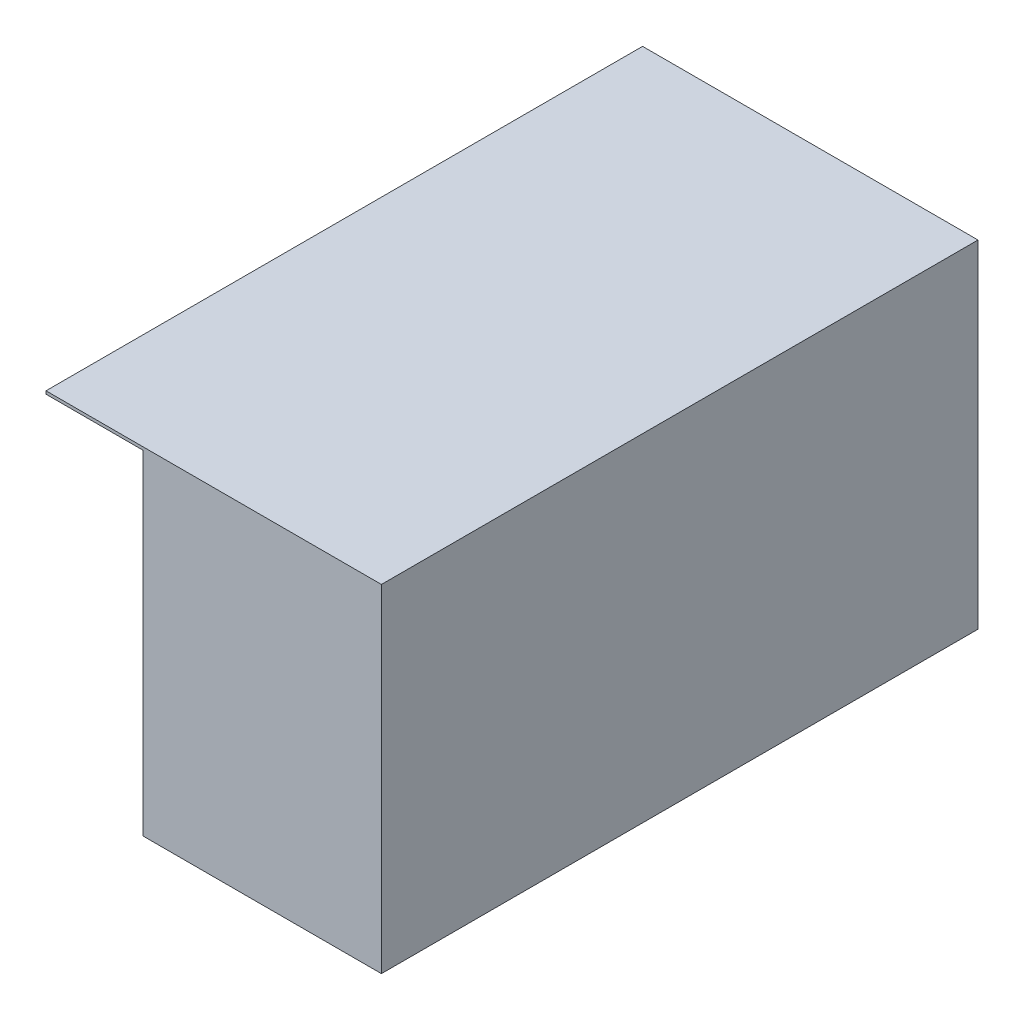
from build123d import *

# Parameters (mm, degrees)
SKETCH2_W           = 80
SKETCH2_H           = 112
BOSS_EXTRUDE2_DEPTH = 200
SKETCH3_W           = 43.75859647
SKETCH3_H           = 72.985244682
CUT_EXTRUDE1_DEPTH  = 70
SKETCH4_W           = 73.021311137
SKETCH4_H           = 192.612336009
CUT_EXTRUDE2_DEPTH  = 110
SKETCH5_W           = 55.513843859
SKETCH5_H           = 4.359725958
BOSS_EXTRUDE3_DEPTH = 30
SKETCH6_W           = 2.442307693
SKETCH6_H           = 19.05
BOSS_EXTRUDE4_DEPTH = 2.5
SKETCH7_W           = 112.444397653
SKETCH7_H           = 200
BOSS_EXTRUDE5_DEPTH = 1
SKETCH8_W           = 80
SKETCH8_H           = 200
BOSS_EXTRUDE6_DEPTH = 0.5
SKETCH9_W           = 29.219763648
SKETCH9_H           = 3.519384488
CUT_EXTRUDE3_DEPTH  = 60


with BuildPart() as part:
    # Sketch2 → Boss-Extrude2 (new body)
    with BuildSketch(Plane.XY):
        with Locations((7.037037037, 44.518518519)):
            Rectangle(SKETCH2_W, SKETCH2_H)
    extrude(amount=BOSS_EXTRUDE2_DEPTH)

    # Sketch3 → Cut-Extrude1 (cut)
    with BuildSketch(Plane.ZY.offset(32.962962963)):
        with Locations((169.213687293, 25.01114086)):
            Rectangle(SKETCH3_W, SKETCH3_H)
    extrude(amount=-CUT_EXTRUDE1_DEPTH, mode=Mode.SUBTRACT)

    # Sketch4 → Cut-Extrude2 (cut)
    with BuildSketch(Plane.XZ.offset(11.481481481)):
        with Locations((6.664479328, 99.376051132)):
            Rectangle(SKETCH4_W, SKETCH4_H)
    extrude(amount=-CUT_EXTRUDE2_DEPTH, mode=Mode.SUBTRACT)

    # Sketch5 → Boss-Extrude3 (add)
    with BuildSketch(Plane.ZY.offset(32.962962963)):
        with Locations((61.523642213, 30.131422859)):
            Rectangle(SKETCH5_W, SKETCH5_H)
    extrude(amount=BOSS_EXTRUDE3_DEPTH)

    # Sketch6 → Boss-Extrude4 (add)
    # profile 1 of 10: a face of its own
    with BuildSketch(Plane.ZY.offset(32.962962963)):
        with BuildLine():
            Line((34.641440783, 90.700838702), (32.695226841, 89.357569471))
            add(Edge.make_bspline(
                [(32.695226841, 89.357569471), (32.462126741, 89.612896003), (32.005805468, 90.112728171), (31.254357046, 90.767477473), (30.467934785, 91.318551672), (29.645431326, 91.764116092), (28.785975839, 92.11292244), (27.885047506, 92.355284544), (26.941705085, 92.504646837), (26.298721089, 92.523147207), (25.971248476, 92.532569471)],
                knots=[0, 0, 0, 0, 1.078723025, 2.111729107, 3.104379151, 4.071093171, 5.02612831, 5.993405043, 6.978038489, 8, 8, 8, 8], degree=3))
            add(Edge.make_bspline(
                [(25.971248476, 92.532569471), (25.800650107, 92.53011051), (25.461261775, 92.525218655), (24.958328239, 92.471436132), (24.463087429, 92.397822867), (23.976005303, 92.285975105), (23.497947164, 92.139755046), (23.025655745, 91.970184234), (22.566283343, 91.760153887), (22.115373688, 91.526706475), (21.679692287, 91.264129872), (21.269319104, 90.972491776), (20.87678796, 90.664823623), (20.513196342, 90.326578843), (20.175226188, 89.963693748), (19.855474167, 89.580734937), (19.562022008, 89.172721204), (19.295997639, 88.740875742), (19.053342732, 88.291632917), (18.849703179, 87.821700195), (18.672905501, 87.3390496), (18.526187259, 86.8411679), (18.417673448, 86.326547022), (18.337211972, 85.796587769), (18.285649654, 85.252463995), (18.280550514, 84.883936365), (18.277979245, 84.698104327)],
                knots=[0, 0, 0, 0, 1.002068956, 1.993515617, 2.969284448, 3.943018425, 4.926742606, 5.905741285, 6.889351865, 7.892340394, 8.888397413, 9.875523532, 10.849114049, 11.817064186, 12.790109362, 13.76151668, 14.746886598, 15.740472426, 16.740336546, 17.744438579, 18.747064952, 19.759451636, 20.791569268, 21.834966327, 22.908270136, 24, 24, 24, 24], degree=3))
            add(Edge.make_bspline(
                [(18.277979245, 84.698104327), (18.283865924, 84.419149445), (18.295389277, 83.873086792), (18.406768841, 83.073513692), (18.580560285, 82.31154838), (18.824858632, 81.587251028), (19.140521035, 80.901444443), (19.526707282, 80.255255325), (19.985639598, 79.647108078), (20.509709912, 79.084863455), (21.080996061, 78.56886796), (21.700167083, 78.127387949), (22.34602049, 77.744020739), (23.031321044, 77.439630722), (23.746384895, 77.197544866), (24.496746238, 77.026060562), (25.28007421, 76.920843465), (25.814456257, 76.908212343), (26.085731649, 76.90180024)],
                knots=[0, 0, 0, 0, 1.083728652, 2.12143175, 3.131304262, 4.117911469, 5.086904967, 6.060353746, 7.03835, 8.042493243, 9.043967071, 10.025107856, 10.993520914, 11.958418665, 12.934074928, 13.923564625, 14.94591178, 16, 16, 16, 16], degree=3))
            add(Edge.make_bspline(
                [(26.085731649, 76.90180024), (26.400528368, 76.91105378), (27.022272111, 76.929330115), (27.936468915, 77.083272491), (28.817320475, 77.331916617), (29.665777844, 77.682427289), (30.482533545, 78.131360442), (31.263750605, 78.682167892), (32.013782938, 79.329868973), (32.46967689, 79.824039994), (32.702859052, 80.07680024)],
                knots=[0, 0, 0, 0, 0.996377973, 1.967910503, 2.926842387, 3.889624876, 4.868586907, 5.872161968, 6.91164629, 8, 8, 8, 8], degree=3))
            Line((32.702859052, 80.07680024), (34.641440783, 78.741163221))
            add(Edge.make_bspline(
                [(34.641440783, 78.741163221), (34.515945311, 78.582013716), (34.266602125, 78.265804342), (33.863931529, 77.81853845), (33.440976569, 77.397886646), (32.993572223, 77.007750731), (32.522197164, 76.648510173), (32.029059997, 76.316005349), (31.5146346, 76.010765115), (30.979202019, 75.736055755), (30.425812564, 75.490187342), (29.853336393, 75.283137347), (29.26726011, 75.100485328), (28.662416025, 74.957489018), (28.041165299, 74.841594532), (27.402545758, 74.763805493), (26.74934981, 74.711154807), (26.308444232, 74.706217351), (26.085731649, 74.703723317)],
                knots=[0, 0, 0, 0, 0.990136069, 1.967271632, 2.938597646, 3.903378639, 4.8655934, 5.832714132, 6.808088679, 7.786607084, 8.77175572, 9.76479442, 10.759640537, 11.769709565, 12.799869661, 13.846050076, 14.911985293, 16, 16, 16, 16], degree=3))
            add(Edge.make_bspline(
                [(26.085731649, 74.703723317), (25.880840354, 74.705111871), (25.476962454, 74.707848964), (24.88009165, 74.753837182), (24.299037615, 74.816023917), (23.735366562, 74.909319123), (23.186418717, 75.021041476), (22.656674777, 75.169172005), (22.138947605, 75.334409152), (21.640770164, 75.534240393), (21.158386226, 75.756462543), (20.690098819, 76.000014157), (20.240514953, 76.274816119), (19.809260397, 76.578199398), (19.391258962, 76.902526548), (18.990738259, 77.255018821), (18.603530995, 77.631187518), (18.364043873, 77.902559218), (18.243634293, 78.038999759)],
                knots=[0, 0, 0, 0, 1.116169561, 2.200172621, 3.260333751, 4.299600589, 5.312386579, 6.311224183, 7.295427787, 8.272379731, 9.233840239, 10.188782295, 11.146938977, 12.102635432, 13.060741968, 14.028403985, 15.00871894, 16, 16, 16, 16], degree=3))
            add(Edge.make_bspline(
                [(18.243634293, 78.038999759), (18.050613264, 78.275895516), (17.668013474, 78.745462317), (17.180383949, 79.508718307), (16.759790982, 80.303109774), (16.425613212, 81.139954811), (16.161472354, 82.009384076), (15.968950384, 82.914050524), (15.858021773, 83.857048717), (15.843204858, 84.498105717), (15.835671552, 84.824035817)],
                knots=[0, 0, 0, 0, 0.995996121, 1.974230005, 2.94855815, 3.923972302, 4.908363682, 5.909282248, 6.937024559, 8, 8, 8, 8], degree=3))
            add(Edge.make_bspline(
                [(15.835671552, 84.824035817), (15.844176316, 85.166677596), (15.860908908, 85.840803905), (16.001828438, 86.830398516), (16.231439442, 87.777041838), (16.547033717, 88.684818847), (16.965228469, 89.546302574), (17.463948961, 90.372625147), (18.067074289, 91.148390062), (18.744924963, 91.880315175), (19.490702613, 92.550157487), (20.296086182, 93.131019107), (21.143876856, 93.627394419), (22.037196804, 94.034016621), (22.978466583, 94.349018912), (23.966130096, 94.566938986), (24.998069656, 94.704926869), (25.701132419, 94.721970512), (26.059018908, 94.730646394)],
                knots=[0, 0, 0, 0, 1.034323922, 2.034967744, 3.011348252, 3.972313581, 4.931003742, 5.898099022, 6.881526582, 7.89265862, 8.907395938, 9.903191422, 10.886146247, 11.869423756, 12.861842533, 13.877618994, 14.91962492, 16, 16, 16, 16], degree=3))
            add(Edge.make_bspline(
                [(26.059018908, 94.730646394), (26.284260403, 94.728038317), (26.730217524, 94.722874569), (27.391400036, 94.671854333), (28.035803647, 94.588109344), (28.66355705, 94.472754635), (29.276518285, 94.330210696), (29.871443282, 94.144345505), (30.451703086, 93.932018258), (31.013391809, 93.686875659), (31.555131134, 93.414166206), (32.070779277, 93.106515005), (32.563899259, 92.775729808), (33.030560469, 92.414915985), (33.473873288, 92.030022635), (33.891672665, 91.616619646), (34.28178179, 91.173030424), (34.521153049, 90.85876294), (34.641440783, 90.700838702)],
                knots=[0, 0, 0, 0, 1.097463626, 2.172875475, 3.229307817, 4.262776093, 5.282168658, 6.293918414, 7.298043722, 8.291879901, 9.278790577, 10.251524626, 11.216027204, 12.170719329, 13.124142787, 14.075306658, 15.032812027, 16, 16, 16, 16], degree=3))
        make_face()
    # profile 2 of 10: a face of its own
    with BuildSketch(Plane.ZY.offset(32.962962963)):
        Polygon((38.549133091, 94.242184855), (40.991440783, 94.242184855), (40.991440783, 86.42680024), (49.539517706, 86.42680024), (49.539517706, 94.242184855), (51.981825399, 94.242184855), (51.981825399, 75.192184855), (49.539517706, 75.192184855), (49.539517706, 84.228723317), (40.991440783, 84.228723317), (40.991440783, 75.192184855), (38.549133091, 75.192184855), align=None)
    # profile 3 of 10: a face of its own
    with BuildSketch(Plane.ZY.offset(32.962962963)):
        Polygon((56.866440783, 94.242184855), (68.101056168, 94.242184855), (68.101056168, 92.044107932), (59.308748476, 92.044107932), (59.308748476, 86.671031009), (68.101056168, 86.671031009), (68.101056168, 84.472954086), (59.308748476, 84.472954086), (59.308748476, 77.390261778), (68.101056168, 77.390261778), (68.101056168, 75.192184855), (56.866440783, 75.192184855), align=None)
    # profile 4 of 10: a face of its own
    with BuildSketch(Plane.ZY.offset(32.962962963)):
        with BuildLine():
            Line((89.104902322, 90.700838702), (87.158688379, 89.357569471))
            add(Edge.make_bspline(
                [(87.158688379, 89.357569471), (86.92558828, 89.612896003), (86.469267006, 90.112728171), (85.717818584, 90.767477473), (84.931396324, 91.318551672), (84.108892864, 91.764116092), (83.249437378, 92.11292244), (82.348509044, 92.355284544), (81.405166623, 92.504646837), (80.762182628, 92.523147207), (80.434710014, 92.532569471)],
                knots=[0, 0, 0, 0, 1.078723025, 2.111729107, 3.104379151, 4.071093171, 5.02612831, 5.993405043, 6.978038489, 8, 8, 8, 8], degree=3))
            add(Edge.make_bspline(
                [(80.434710014, 92.532569471), (80.264111646, 92.53011051), (79.924723314, 92.525218655), (79.421789777, 92.471436132), (78.926548968, 92.397822867), (78.439466842, 92.285975105), (77.961408702, 92.139755046), (77.489117284, 91.970184234), (77.029744882, 91.760153887), (76.578835226, 91.526706475), (76.143153825, 91.264129872), (75.732780643, 90.972491776), (75.340249499, 90.664823623), (74.97665788, 90.326578843), (74.638687726, 89.963693748), (74.318935705, 89.580734937), (74.025483546, 89.172721204), (73.759459177, 88.740875742), (73.51680427, 88.291632917), (73.313164718, 87.821700195), (73.13636704, 87.3390496), (72.989648798, 86.8411679), (72.881134986, 86.326547022), (72.80067351, 85.796587769), (72.749111192, 85.252463995), (72.744012052, 84.883936365), (72.741440783, 84.698104327)],
                knots=[0, 0, 0, 0, 1.002068956, 1.993515617, 2.969284448, 3.943018425, 4.926742606, 5.905741285, 6.889351865, 7.892340394, 8.888397413, 9.875523532, 10.849114049, 11.817064186, 12.790109362, 13.76151668, 14.746886598, 15.740472426, 16.740336546, 17.744438579, 18.747064952, 19.759451636, 20.791569268, 21.834966327, 22.908270136, 24, 24, 24, 24], degree=3))
            add(Edge.make_bspline(
                [(72.741440783, 84.698104327), (72.747327462, 84.419149445), (72.758850815, 83.873086792), (72.870230379, 83.073513692), (73.044021823, 82.31154838), (73.288320171, 81.587251028), (73.603982574, 80.901444443), (73.99016882, 80.255255325), (74.449101137, 79.647108078), (74.973171451, 79.084863455), (75.544457599, 78.56886796), (76.163628621, 78.127387949), (76.809482028, 77.744020739), (77.494782582, 77.439630722), (78.209846434, 77.197544866), (78.960207777, 77.026060562), (79.743535749, 76.920843465), (80.277917795, 76.908212343), (80.549193187, 76.90180024)],
                knots=[0, 0, 0, 0, 1.083728652, 2.12143175, 3.131304262, 4.117911469, 5.086904967, 6.060353746, 7.03835, 8.042493243, 9.043967071, 10.025107856, 10.993520914, 11.958418665, 12.934074928, 13.923564625, 14.94591178, 16, 16, 16, 16], degree=3))
            add(Edge.make_bspline(
                [(80.549193187, 76.90180024), (80.863989906, 76.91105378), (81.485733649, 76.929330115), (82.399930453, 77.083272491), (83.280782013, 77.331916617), (84.129239383, 77.682427289), (84.945995083, 78.131360442), (85.727212143, 78.682167892), (86.477244477, 79.329868973), (86.933138428, 79.824039994), (87.166320591, 80.07680024)],
                knots=[0, 0, 0, 0, 0.996377973, 1.967910503, 2.926842387, 3.889624876, 4.868586907, 5.872161968, 6.91164629, 8, 8, 8, 8], degree=3))
            Line((87.166320591, 80.07680024), (89.104902322, 78.741163221))
            add(Edge.make_bspline(
                [(89.104902322, 78.741163221), (88.97940685, 78.582013716), (88.730063663, 78.265804342), (88.327393067, 77.81853845), (87.904438107, 77.397886646), (87.457033762, 77.007750731), (86.985658702, 76.648510173), (86.492521535, 76.316005349), (85.978096138, 76.010765115), (85.442663557, 75.736055755), (84.889274102, 75.490187342), (84.316797932, 75.283137347), (83.730721649, 75.100485328), (83.125877563, 74.957489018), (82.504626837, 74.841594532), (81.866007296, 74.763805493), (81.212811348, 74.711154807), (80.771905771, 74.706217351), (80.549193187, 74.703723317)],
                knots=[0, 0, 0, 0, 0.990136069, 1.967271632, 2.938597646, 3.903378639, 4.8655934, 5.832714132, 6.808088679, 7.786607084, 8.77175572, 9.76479442, 10.759640537, 11.769709565, 12.799869661, 13.846050076, 14.911985293, 16, 16, 16, 16], degree=3))
            add(Edge.make_bspline(
                [(80.549193187, 74.703723317), (80.344301892, 74.705111871), (79.940423993, 74.707848964), (79.343553188, 74.753837182), (78.762499153, 74.816023917), (78.1988281, 74.909319123), (77.649880256, 75.021041476), (77.120136316, 75.169172005), (76.602409143, 75.334409152), (76.104231703, 75.534240393), (75.621847764, 75.756462543), (75.153560357, 76.000014157), (74.703976492, 76.274816119), (74.272721935, 76.578199398), (73.8547205, 76.902526548), (73.454199798, 77.255018821), (73.066992533, 77.631187518), (72.827505411, 77.902559218), (72.707095831, 78.038999759)],
                knots=[0, 0, 0, 0, 1.116169561, 2.200172621, 3.260333751, 4.299600589, 5.312386579, 6.311224183, 7.295427787, 8.272379731, 9.233840239, 10.188782295, 11.146938977, 12.102635432, 13.060741968, 14.028403985, 15.00871894, 16, 16, 16, 16], degree=3))
            add(Edge.make_bspline(
                [(72.707095831, 78.038999759), (72.514074802, 78.275895516), (72.131475012, 78.745462317), (71.643845487, 79.508718307), (71.223252521, 80.303109774), (70.88907475, 81.139954811), (70.624933892, 82.009384076), (70.432411923, 82.914050524), (70.321483312, 83.857048717), (70.306666397, 84.498105717), (70.299133091, 84.824035817)],
                knots=[0, 0, 0, 0, 0.995996121, 1.974230005, 2.94855815, 3.923972302, 4.908363682, 5.909282248, 6.937024559, 8, 8, 8, 8], degree=3))
            add(Edge.make_bspline(
                [(70.299133091, 84.824035817), (70.307637855, 85.166677596), (70.324370447, 85.840803905), (70.465289977, 86.830398516), (70.694900981, 87.777041838), (71.010495256, 88.684818847), (71.428690007, 89.546302574), (71.9274105, 90.372625147), (72.530535828, 91.148390062), (73.208386501, 91.880315175), (73.954164152, 92.550157487), (74.759547721, 93.131019107), (75.607338394, 93.627394419), (76.500658343, 94.034016621), (77.441928121, 94.349018912), (78.429591635, 94.566938986), (79.461531195, 94.704926869), (80.164593957, 94.721970512), (80.522480447, 94.730646394)],
                knots=[0, 0, 0, 0, 1.034323922, 2.034967744, 3.011348252, 3.972313581, 4.931003742, 5.898099022, 6.881526582, 7.89265862, 8.907395938, 9.903191422, 10.886146247, 11.869423756, 12.861842533, 13.877618994, 14.91962492, 16, 16, 16, 16], degree=3))
            add(Edge.make_bspline(
                [(80.522480447, 94.730646394), (80.747721941, 94.728038317), (81.193679062, 94.722874569), (81.854861574, 94.671854333), (82.499265186, 94.588109344), (83.127018588, 94.472754635), (83.739979824, 94.330210696), (84.33490482, 94.144345505), (84.915164625, 93.932018258), (85.476853348, 93.686875659), (86.018592673, 93.414166206), (86.534240815, 93.106515005), (87.027360797, 92.775729808), (87.494022008, 92.414915985), (87.937334826, 92.030022635), (88.355134203, 91.616619646), (88.745243329, 91.173030424), (88.984614587, 90.85876294), (89.104902322, 90.700838702)],
                knots=[0, 0, 0, 0, 1.097463626, 2.172875475, 3.229307817, 4.262776093, 5.282168658, 6.293918414, 7.298043722, 8.291879901, 9.278790577, 10.251524626, 11.216027204, 12.170719329, 13.124142787, 14.075306658, 15.032812027, 16, 16, 16, 16], degree=3))
        make_face()
    # profile 5 of 10: a face of its own
    with BuildSketch(Plane.ZY.offset(32.962962963)):
        Polygon((93.012594629, 94.242184855), (95.454902322, 94.242184855), (95.454902322, 87.251079086), (102.56430737, 94.242184855), (105.590479245, 94.242184855), (96.454722033, 85.686475721), (106.323171552, 75.192184855), (103.445827802, 75.192184855), (95.454902322, 84.121872355), (95.454902322, 75.192184855), (93.012594629, 75.192184855), align=None)
    # profile 6 of 10: a face of its own
    with BuildSketch(Plane.ZY.offset(32.962962963)):
        with BuildLine():
            Line((116.458748476, 94.242184855), (120.362624677, 94.242184855))
            add(Edge.make_bspline(
                [(120.362624677, 94.242184855), (120.620862852, 94.242044172), (121.115765181, 94.241774558), (121.825508049, 94.223504632), (122.46940465, 94.207736172), (123.048406377, 94.177427844), (123.561194984, 94.135911245), (124.007954552, 94.087092697), (124.389164772, 94.032185317), (124.61906441, 93.982544668), (124.724433572, 93.959793028)],
                knots=[0, 0, 0, 0, 1.415450773, 2.712650385, 3.891531898, 4.945867971, 5.890285756, 6.71109784, 7.409261617, 8, 8, 8, 8], degree=3))
            add(Edge.make_bspline(
                [(124.724433572, 93.959793028), (124.872765644, 93.921648597), (125.165379357, 93.846401327), (125.583681546, 93.691294449), (125.980593815, 93.515047457), (126.354761035, 93.314560542), (126.702361235, 93.083008904), (127.030893714, 92.831431675), (127.330253307, 92.547104435), (127.610695828, 92.243820528), (127.856757712, 91.914652706), (128.07722987, 91.570739019), (128.259967757, 91.207084215), (128.410147383, 90.825040966), (128.527548226, 90.426601167), (128.611996347, 90.010495327), (128.662740311, 89.577635904), (128.667740318, 89.282658199), (128.670286937, 89.13241923)],
                knots=[0, 0, 0, 0, 1.085641105, 2.141637125, 3.15936318, 4.164535163, 5.147931294, 6.118832473, 7.09541784, 8.072503165, 9.045079613, 10.006206652, 10.966486436, 11.926469503, 12.914201526, 13.908586125, 14.934794539, 16, 16, 16, 16], degree=3))
            add(Edge.make_bspline(
                [(128.670286937, 89.13241923), (128.667684447, 88.982187262), (128.662552843, 88.685959145), (128.612129318, 88.250512027), (128.527604667, 87.83354178), (128.413649682, 87.43320636), (128.26388755, 87.051995518), (128.0849342, 86.68669094), (127.868613917, 86.34143144), (127.621658807, 86.013820549), (127.342776017, 85.708892946), (127.036007332, 85.427806012), (126.697320371, 85.17546882), (126.330188764, 84.947352178), (125.935891787, 84.739455938), (125.510462776, 84.560642354), (125.055799778, 84.40827615), (124.740253399, 84.327258864), (124.579421552, 84.285964903)],
                knots=[0, 0, 0, 0, 1.042501879, 2.055610221, 3.037454288, 3.993184118, 4.940927036, 5.876790881, 6.812738028, 7.76458517, 8.720845088, 9.677105007, 10.648370915, 11.647960469, 12.67482723, 13.739162042, 14.847666245, 16, 16, 16, 16], degree=3))
            add(Edge.make_bspline(
                [(124.579421552, 84.285964903), (124.461383496, 84.260373403), (124.203885915, 84.204546073), (123.776584168, 84.146453739), (123.278690407, 84.098861068), (122.708631007, 84.057454562), (122.068742634, 84.022672727), (121.356187013, 84.001967935), (120.572589278, 83.985260702), (120.025546294, 83.984755632), (119.740599437, 83.984492548)],
                knots=[0, 0, 0, 0, 0.596754895, 1.30180848, 2.129432098, 3.068723067, 4.126429569, 5.296393252, 6.591729958, 8, 8, 8, 8], degree=3))
            Line((119.740599437, 83.984492548), (118.901056168, 83.984492548))
            Line((118.901056168, 83.984492548), (118.901056168, 75.192184855))
            Line((118.901056168, 75.192184855), (116.458748476, 75.192184855))
            Line((116.458748476, 75.192184855), (116.458748476, 94.242184855))
        make_face()
        with BuildLine():
            Line((118.901056168, 92.044107932), (118.901056168, 86.174937259))
            Line((118.901056168, 86.174937259), (121.648652322, 86.144408413))
            add(Edge.make_bspline(
                [(121.648652322, 86.144408413), (121.803846425, 86.146454853), (122.102856593, 86.150397699), (122.534351634, 86.164087721), (122.931235431, 86.191911767), (123.294274634, 86.224362434), (123.624202627, 86.269858421), (123.919534101, 86.326639614), (124.182787259, 86.39043636), (124.483820994, 86.490738966), (124.820781236, 86.647353544), (125.179006782, 86.886314997), (125.49477025, 87.172095284), (125.755543254, 87.508458125), (125.965402569, 87.879063787), (126.121396294, 88.275172822), (126.209691549, 88.696051531), (126.221831701, 88.983197722), (126.227979245, 89.128603125)],
                knots=[0, 0, 0, 0, 1.196816259, 2.305888068, 3.328295896, 4.264290022, 5.116006351, 5.89509982, 6.582615619, 7.202969204, 8.339503699, 9.435837163, 10.511976311, 11.608836183, 12.702577786, 13.786378287, 14.879063815, 16, 16, 16, 16], degree=3))
            add(Edge.make_bspline(
                [(126.227979245, 89.128603125), (126.221787294, 89.268934251), (126.209505794, 89.547275764), (126.120748996, 89.956645302), (125.964683277, 90.344944983), (125.754482145, 90.710344623), (125.499048279, 91.044325371), (125.196474713, 91.331631394), (124.854045193, 91.566440446), (124.534360891, 91.716831495), (124.249313151, 91.814703207), (123.99808455, 91.872196005), (123.71427299, 91.925950974), (123.396116081, 91.972034103), (123.04331783, 92.005270015), (122.656303521, 92.026589053), (122.236476164, 92.043295862), (121.945055688, 92.043830297), (121.793664341, 92.044107932)],
                knots=[0, 0, 0, 0, 1.113934591, 2.209447376, 3.306634974, 4.424089692, 5.547326231, 6.633252657, 7.723023745, 8.829884498, 9.427152571, 10.113060991, 10.873719268, 11.720735618, 12.664423995, 13.686322671, 14.798057257, 16, 16, 16, 16], degree=3))
            Line((121.793664341, 92.044107932), (118.901056168, 92.044107932))
        make_face(mode=Mode.SUBTRACT)
    # profile 7 of 10: a face of its own
    with BuildSketch(Plane.ZY.offset(32.962962963)):
        with BuildLine():
            add(Edge.make_bspline(
                [(141.251987658, 94.730646394), (141.617514542, 94.722207673), (142.335964942, 94.705621197), (143.389927138, 94.56420429), (144.39642783, 94.337966576), (145.353982424, 94.014818418), (146.263237384, 93.600767772), (147.125627172, 93.095018898), (147.93859087, 92.496039691), (148.692188974, 91.811508509), (149.376739513, 91.065847265), (149.983397982, 90.2776347), (150.48715949, 89.443380957), (150.908278894, 88.575158179), (151.226924012, 87.664911802), (151.463005903, 86.720353966), (151.602241113, 85.735156834), (151.61931602, 85.0648884), (151.627979245, 84.724817067)],
                knots=[0, 0, 0, 0, 1.090651108, 2.14369656, 3.167927427, 4.165692988, 5.154576575, 6.145033357, 7.14440862, 8.163220312, 9.178978109, 10.162394332, 11.12677451, 12.082874982, 13.037579715, 13.999894772, 14.985214855, 16, 16, 16, 16], degree=3))
            add(Edge.make_bspline(
                [(151.627979245, 84.724817067), (151.61948259, 84.387246889), (151.602737287, 83.721959754), (151.460826796, 82.742766055), (151.232043799, 81.799352762), (150.911650376, 80.889882707), (150.491354787, 80.021293014), (149.985073784, 79.186296279), (149.382065216, 78.392868282), (148.700069127, 77.64198736), (147.950601514, 76.954998586), (147.145872, 76.351668525), (146.295641977, 75.843856977), (145.404147017, 75.421127128), (144.464094316, 75.103754091), (143.482502954, 74.868408706), (142.455509088, 74.729360415), (141.756134056, 74.712360263), (141.400815783, 74.703723317)],
                knots=[0, 0, 0, 0, 1.015667565, 2.001689161, 2.971180881, 3.933912672, 4.898051938, 5.870540525, 6.8683264, 7.892867857, 8.919988739, 9.923897136, 10.914753654, 11.896185405, 12.887840524, 13.895451133, 14.930781579, 16, 16, 16, 16], degree=3))
            add(Edge.make_bspline(
                [(141.400815783, 74.703723317), (141.05432821, 74.712099117), (140.372543812, 74.728580199), (139.372355171, 74.871343271), (138.412757835, 75.093900971), (137.49499166, 75.413758628), (136.617598884, 75.821731268), (135.785578257, 76.327811762), (134.991578193, 76.917240016), (134.250701598, 77.592482069), (133.574551128, 78.331912146), (132.981464346, 79.119007329), (132.477040695, 79.94375482), (132.066700889, 80.807097954), (131.747033047, 81.709856681), (131.525276832, 82.65181401), (131.381717501, 83.630285137), (131.365204289, 84.295630703), (131.356825399, 84.633230528)],
                knots=[0, 0, 0, 0, 1.056734814, 2.079339537, 3.076314658, 4.058285941, 5.039336339, 6.023146808, 7.024524339, 8.052147497, 9.076900738, 10.077495695, 11.054668894, 12.021676166, 12.988994953, 13.970866516, 14.970407042, 16, 16, 16, 16], degree=3))
            add(Edge.make_bspline(
                [(131.356825399, 84.633230528), (131.359732664, 84.859832242), (131.365510519, 85.310176988), (131.43517329, 85.978906988), (131.536054251, 86.636955106), (131.681391748, 87.282106754), (131.868853984, 87.914476742), (132.099909319, 88.532736541), (132.364551181, 89.142111677), (132.68020553, 89.730506135), (133.022917755, 90.301336995), (133.403745562, 90.839272854), (133.80657707, 91.350864087), (134.24837293, 91.822453831), (134.714361657, 92.2678674), (135.212159059, 92.68023179), (135.738712593, 93.063272935), (136.296292017, 93.408460699), (136.871157149, 93.720658299), (137.46375791, 93.988565796), (138.066045817, 94.218505075), (138.68084183, 94.404872995), (139.306513346, 94.552004505), (139.944425917, 94.652193102), (140.594071337, 94.721994032), (141.031738659, 94.727749864), (141.251987658, 94.730646394)],
                knots=[0, 0, 0, 0, 1.036913812, 2.060746492, 3.074578145, 4.08324605, 5.085523353, 6.091481477, 7.103103322, 8.124200051, 9.145827961, 10.149052085, 11.139400635, 12.124186929, 13.104469564, 14.088618662, 15.081002312, 16.082788945, 17.088477375, 18.073521874, 19.057670972, 20.037642247, 21.012252997, 21.997331918, 22.992189685, 24, 24, 24, 24], degree=3))
        make_face()
        with BuildLine():
            add(Edge.make_bspline(
                [(141.332125879, 92.532569471), (141.171707499, 92.530030128), (140.852631763, 92.524979319), (140.377294083, 92.4721103), (139.906878604, 92.392693403), (139.440570521, 92.281002019), (138.977985377, 92.141441314), (138.523104726, 91.962904001), (138.071533488, 91.758626484), (137.631326485, 91.516480893), (137.202198116, 91.253632424), (136.796305643, 90.960197024), (136.408990677, 90.648287157), (136.045834685, 90.30739458), (135.707519467, 89.941982253), (135.392166298, 89.552651208), (135.097368218, 89.140748043), (134.829580835, 88.703417684), (134.582249069, 88.24971138), (134.374051512, 87.776691898), (134.197692752, 87.289392081), (134.052949451, 86.788325003), (133.936980755, 86.272499423), (133.859391244, 85.741724119), (133.806354602, 85.196547795), (133.801564849, 84.827983057), (133.799133091, 84.64086274)],
                knots=[0, 0, 0, 0, 0.951425037, 1.892405618, 2.834142553, 3.780555396, 4.735506122, 5.698386817, 6.677778342, 7.674036042, 8.677244726, 9.661625187, 10.643485342, 11.625954439, 12.613944774, 13.595804929, 14.596853729, 15.616869823, 16.636634596, 17.660413109, 18.67984269, 19.709280547, 20.753005387, 21.813969624, 22.890152378, 24, 24, 24, 24], degree=3))
            add(Edge.make_bspline(
                [(133.799133091, 84.64086274), (133.805040188, 84.36825806), (133.816626122, 83.833582523), (133.928361222, 83.049317235), (134.101589059, 82.299894941), (134.346785003, 81.586074124), (134.662500826, 80.908070783), (135.048913022, 80.266080778), (135.506669349, 79.658495405), (136.030308702, 79.096990265), (136.597986205, 78.583930507), (137.200122731, 78.136856051), (137.822932644, 77.750261004), (138.476411016, 77.44039322), (139.154152492, 77.198908381), (139.857307651, 77.027075151), (140.586006365, 76.920832892), (141.081172632, 76.908201769), (141.332125879, 76.90180024)],
                knots=[0, 0, 0, 0, 1.087324682, 2.132633634, 3.154656843, 4.153212625, 5.138884617, 6.133989092, 7.13811672, 8.169089965, 9.193543553, 10.187520856, 11.158295186, 12.114249704, 13.068004623, 14.02467326, 14.998892505, 16, 16, 16, 16], degree=3))
            add(Edge.make_bspline(
                [(141.332125879, 76.90180024), (141.510333274, 76.904346274), (141.863641235, 76.909393954), (142.387381249, 76.961525435), (142.900758363, 77.041905206), (143.404075061, 77.150109798), (143.895832878, 77.299345606), (144.379742764, 77.471031828), (144.850493034, 77.685142845), (145.311465454, 77.922011513), (145.75089186, 78.19442268), (146.173724453, 78.484014537), (146.571418501, 78.79911439), (146.936346277, 79.146021925), (147.283385151, 79.50902226), (147.603115477, 79.898300542), (147.897773179, 80.311315381), (148.164402792, 80.746744196), (148.403559728, 81.199371188), (148.616128826, 81.665839318), (148.788903143, 82.146836689), (148.937161158, 82.637658518), (149.046472864, 83.143313958), (149.125513627, 83.66074365), (149.178280656, 84.190747371), (149.183187841, 84.54787658), (149.185671552, 84.728633173)],
                knots=[0, 0, 0, 0, 1.036970321, 2.055862331, 3.060095599, 4.060719653, 5.049301004, 6.049377071, 7.046955997, 8.056986028, 9.063944937, 10.053856218, 11.039021426, 12.013303897, 12.982198174, 13.960523328, 14.942567566, 15.933032457, 16.929951754, 17.920776327, 18.913894254, 19.902475604, 20.903099658, 21.921964767, 22.948227815, 24, 24, 24, 24], degree=3))
            add(Edge.make_bspline(
                [(149.185671552, 84.728633173), (149.18317646, 84.908117422), (149.178247147, 85.262707097), (149.12577871, 85.787667291), (149.04656547, 86.298764511), (148.936485222, 86.79785288), (148.789653699, 87.282745771), (148.615990294, 87.757154353), (148.403549004, 88.216031609), (148.164256371, 88.660955454), (147.897108413, 89.09060428), (147.599032456, 89.496918251), (147.278219649, 89.884596602), (146.929918261, 90.247926891), (146.553898584, 90.588233121), (146.153731548, 90.908064149), (145.728212662, 91.208652522), (145.276290031, 91.479352356), (144.810031537, 91.728079973), (144.331917507, 91.940192047), (143.850216963, 92.125832003), (143.360488424, 92.274967919), (142.862824657, 92.388680263), (142.358461317, 92.473518075), (141.847091522, 92.524516309), (141.503963512, 92.529882231), (141.332125879, 92.532569471)],
                knots=[0, 0, 0, 0, 1.048789873, 2.071992723, 3.080474812, 4.070813472, 5.056451928, 6.039816187, 7.021295338, 8.009314668, 8.991328769, 9.975844821, 10.952581135, 11.930703152, 12.91499457, 13.914777939, 14.923479275, 15.957618598, 16.991998452, 18.010408503, 19.012925223, 20.00783076, 20.999814803, 21.994803685, 22.995802798, 24, 24, 24, 24], degree=3))
        make_face(mode=Mode.SUBTRACT)
    # profile 8 of 10: a face of its own
    with BuildSketch(Plane.ZY.offset(32.962962963)):
        with Locations((156.756825398, 84.717184855)):
            Rectangle(SKETCH6_W, SKETCH6_H)
    # profile 9 of 10: a face of its own
    with BuildSketch(Plane.ZY.offset(32.962962963)):
        Polygon((162.374133091, 75.192184855), (162.374133091, 94.242184855), (163.278550158, 94.242184855), (174.829902322, 79.767695673), (174.829902322, 94.242184855), (177.272210014, 94.242184855), (177.272210014, 75.192184855), (176.272390302, 75.192184855), (164.816440783, 89.62851298), (164.816440783, 75.192184855), align=None)
    # profile 10 of 10: a face of its own
    with BuildSketch(Plane.ZY.offset(32.962962963)):
        Polygon((179.958748476, 92.044107932), (179.958748476, 94.242184855), (190.704902322, 94.242184855), (190.704902322, 92.044107932), (186.552979245, 92.044107932), (186.552979245, 75.192184855), (184.110671552, 75.192184855), (184.110671552, 92.044107932), align=None)
    extrude(amount=BOSS_EXTRUDE4_DEPTH)

    # Sketch7 → Boss-Extrude5 (add)
    with BuildSketch(Plane(origin=(0, 100.518518519, 0), x_dir=(1, 0, 0), z_dir=(0, 1, 0))):
        with Locations((-9.18516179, -100)):
            Rectangle(SKETCH7_W, SKETCH7_H)
    extrude(amount=BOSS_EXTRUDE5_DEPTH)

    # Sketch8 → Boss-Extrude6 (add)
    with BuildSketch(Plane.XZ.offset(11.481481481)):
        with Locations((7.037037037, 100)):
            Rectangle(SKETCH8_W, SKETCH8_H)
    extrude(amount=-BOSS_EXTRUDE6_DEPTH)

    # Sketch9 → Cut-Extrude3 (cut)
    with BuildSketch(Plane.XY.offset(89.280564142)):
        with Locations((-47.97246797, 30.115413056)):
            Rectangle(SKETCH9_W, SKETCH9_H)
    extrude(amount=-CUT_EXTRUDE3_DEPTH, mode=Mode.SUBTRACT)


solid = part.part
